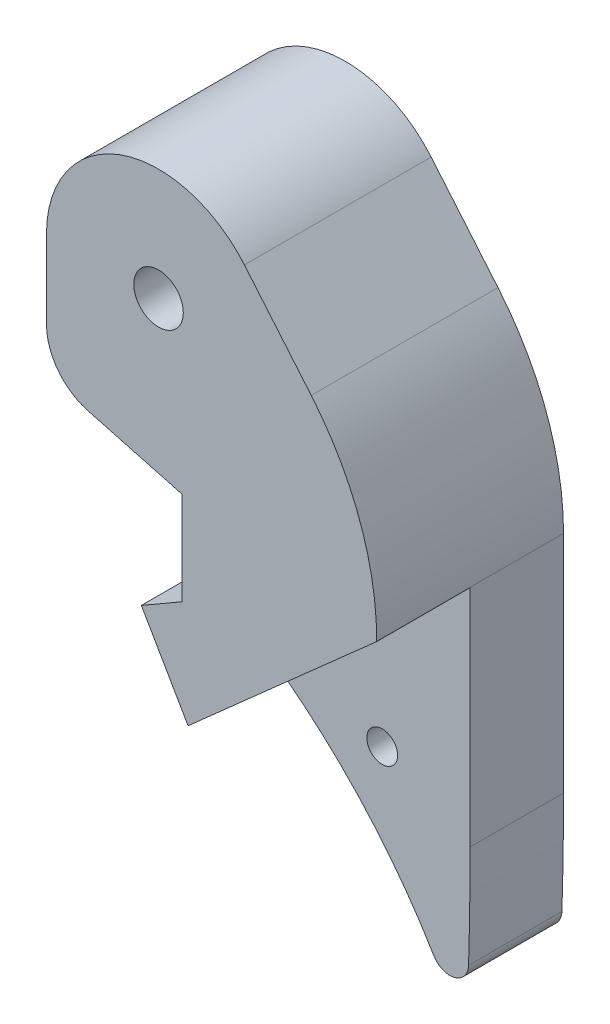
from build123d import *

# Parameters (mm, degrees)
SKETCH_1_R          = 2.65
EXTRUDE_1_DEPTH     = 20
CUT_EXTRUDE_1_DEPTH = 10
FILLET_1_R          = 2
FILLET_2_R          = 30
SKETCH_3_R          = 1.65
CUT_EXTRUDE_2_DEPTH = 58.468525672
FILLET_3_R          = 6


with BuildPart() as part:
    # 草图1 → 凸台-拉伸1 (new body)
    with BuildSketch(Plane.XY):
        with BuildLine():
            Line((0, 0), (0, 13))
            ThreePointArc((0, 13), (7.89575828, 24.276311449), (21.192533317, 20.713451316))
            Line((21.192533317, 20.713451316), (35.365655494, 3.822582044))
            Line((35.365655494, 3.822582044), (35.365655494, -31.177417956))
            ThreePointArc((35.365655494, -31.177417956), (35.245743493, -40.47423292), (34.886087273, -49.764862326))
            ThreePointArc((34.886087273, -49.764862326), (26.594605872, -36.149168843), (15.158760375, -25.042539714))
            Line((15.158760375, -25.042539714), (10.158760375, -16.382285677))
            Line((10.158760375, -16.382285677), (14.488887394, -13.882285677))
            Line((14.488887394, -13.882285677), (14.488887394, -3.882285677))
            Line((14.488887394, -3.882285677), (0, 0))
        make_face()
        with Locations((12, 13)):
            Circle(SKETCH_1_R, mode=Mode.SUBTRACT)
    extrude(amount=EXTRUDE_1_DEPTH)

    # 草图2 → 切除-拉伸1 (cut)
    with BuildSketch(Plane.XY.offset(20)):
        Polygon((15.158760375, -25.042539714), (35.365655494, -7.132145445), (35.365655494, -70.887668239), (13.758782183, -70.887668239), align=None)
    extrude(amount=-CUT_EXTRUDE_1_DEPTH, mode=Mode.SUBTRACT)

    # 圆角1
    fillet_1_edges = [part.edges().sort_by_distance(p)[0] for p in [
        (34.886087273, -49.764862326, 5),
    ]]
    fillet(fillet_1_edges, radius=FILLET_1_R)

    # 圆角2
    fillet_2_edges = [part.edges().sort_by_distance(p)[0] for p in [
        (35.365655494, 3.822582044, 10),
    ]]
    fillet(fillet_2_edges, radius=FILLET_2_R)

    # 草图3 → 切除-拉伸2 (cut, through all)
    with BuildSketch(Plane.XY.offset(10)):
        with Locations((25.95004871, -26.58161927)):
            Circle(SKETCH_3_R)
    extrude(amount=-CUT_EXTRUDE_2_DEPTH, mode=Mode.SUBTRACT)

    # 圆角3
    fillet_3_edges = [part.edges().sort_by_distance(p)[0] for p in [
        (0, 0, 10),
    ]]
    fillet(fillet_3_edges, radius=FILLET_3_R)


solid = part.part
